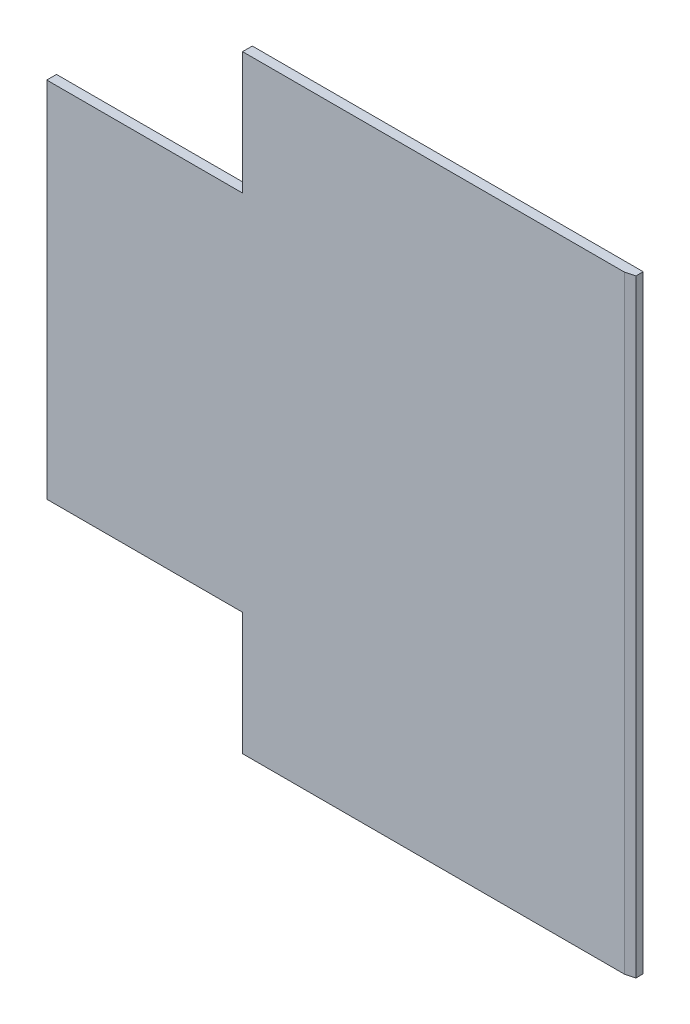
from build123d import *

# Parameters (mm, degrees)
SKETCH1_W           = 79.31
SKETCH1_H           = 3.17
BOSS_EXTRUDE1_DEPTH = 198
SKETCH2_W           = 3.17
SKETCH2_H           = 118.22
BOSS_EXTRUDE2_DEPTH = 63.76
SKETCH3_W           = 3.17
SKETCH3_H           = 198
BOSS_EXTRUDE3_DEPTH = 48
CUT_EXTRUDE1_DEPTH  = 200


with BuildPart() as part:
    # Sketch1 → Boss-Extrude1 (new body)
    with BuildSketch(Plane(origin=(0, 0, 0), x_dir=(1, 0, 0), z_dir=(0, 1, 0))):
        with Locations((39.655, 1.585)):
            Rectangle(SKETCH1_W, SKETCH1_H)
    extrude(amount=BOSS_EXTRUDE1_DEPTH)

    # Sketch2 → Boss-Extrude2 (add)
    with BuildSketch(Plane.ZY):
        with Locations((-1.585, 99)):
            Rectangle(SKETCH2_W, SKETCH2_H)
    extrude(amount=BOSS_EXTRUDE2_DEPTH)

    # Sketch3 → Boss-Extrude3 (add)
    with BuildSketch(Plane(origin=(79.31, 0, 0), x_dir=(0, 0, -1), z_dir=(1, 0, 0))):
        with Locations((1.585, 99)):
            Rectangle(SKETCH3_W, SKETCH3_H)
    extrude(amount=BOSS_EXTRUDE3_DEPTH)

    # Sketch5 → Cut-Extrude1 (cut)
    with BuildSketch(Plane(origin=(0, 198, 0), x_dir=(1, 0, 0), z_dir=(0, 1, 0))):
        Polygon((124.301364544, 0), (127.332496868, 0.810264437), (127.332496868, 0), align=None)
    extrude(amount=-CUT_EXTRUDE1_DEPTH, mode=Mode.SUBTRACT)


solid = part.part
